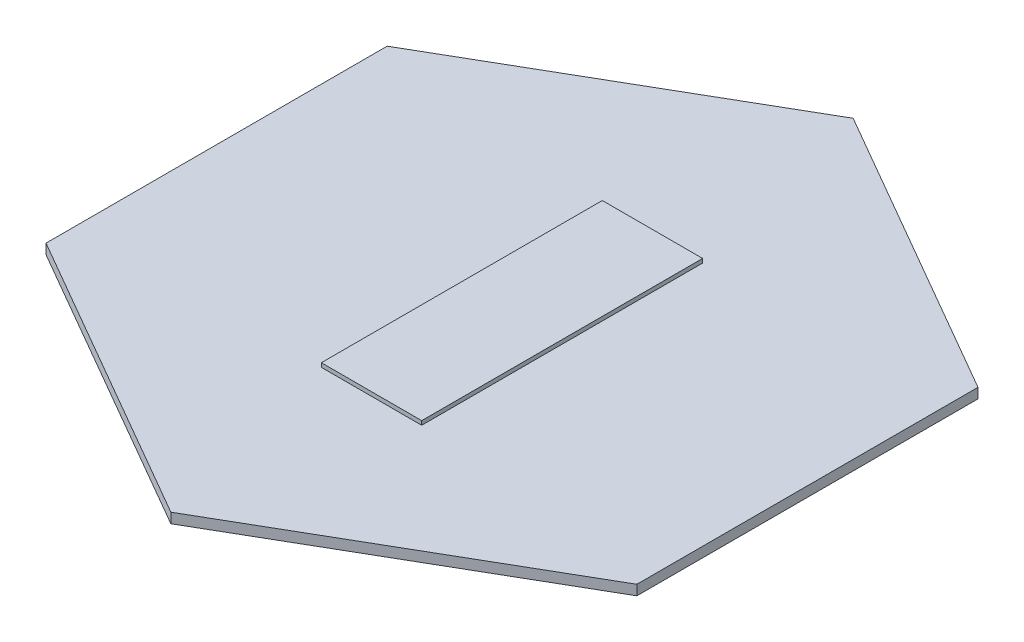
from build123d import *

# Parameters (mm, degrees)
BOSS_EXTRUDE1_DEPTH = 2.5
SKETCH2_W           = 25
SKETCH2_H           = 70
BOSS_EXTRUDE2_DEPTH = 1


with BuildPart() as part:
    # Sketch1 → Boss-Extrude1 (new body)
    with BuildSketch(Plane(origin=(0, 0, 0), x_dir=(1, 0, 0), z_dir=(0, 1, 0))):
        Polygon((73.612159322, 42.5), (0, 85), (-73.612159322, 42.5), (-73.612159322, -42.5), (0, -85), (73.612159322, -42.5), align=None)
    extrude(amount=BOSS_EXTRUDE1_DEPTH)

    # Sketch2 → Boss-Extrude2 (add)
    with BuildSketch(Plane(origin=(0, 2.5, 0), x_dir=(1, 0, 0), z_dir=(0, 1, 0))):
        Rectangle(SKETCH2_W, SKETCH2_H)
    extrude(amount=BOSS_EXTRUDE2_DEPTH)


solid = part.part
